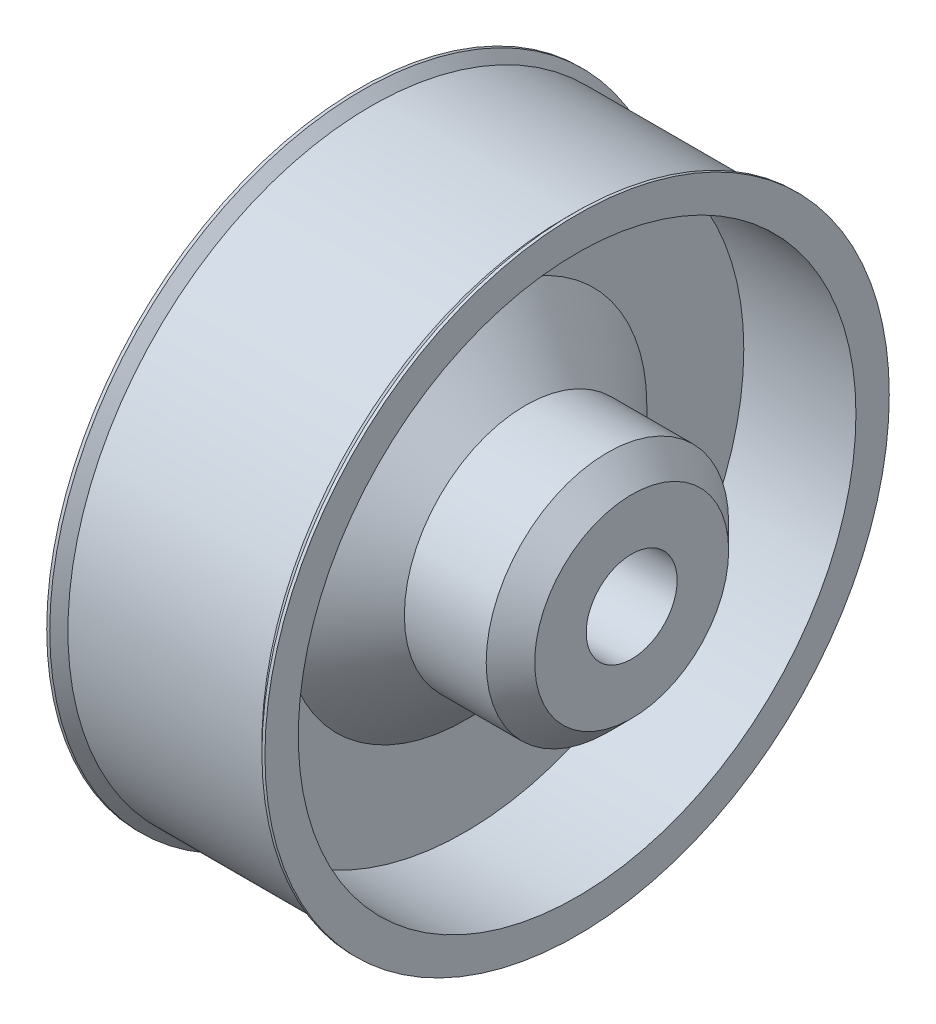
from build123d import *

# Parameters (mm, degrees)
BOSS_EXTRUDE1_DEPTH = 3
CIRPATTERN1_COUNT   = 8
BOSS_EXTRUDE2_DEPTH = 3
CIRPATTERN2_COUNT   = 6


with BuildPart() as part:
    # Sketch1 → Revolve1 (revolve)
    with BuildSketch(Plane.XY, mode=Mode.PRIVATE) as revolve1_sk:
        with BuildLine():
            Line((-7.5, 6), (-17.506303134, 3.75))
            Line((-17.506303134, 3.75), (-18, 0))
            Line((-18, 0), (0, 0))
            Line((0, 0), (0, 7.5))
            Line((0, 7.5), (27.5, 7.5))
            Line((27.5, 7.5), (27.5, 16))
            Line((27.5, 16), (23.5, 20))
            Line((23.5, 20), (10, 20))
            Line((10, 20), (0, 30))
            Line((0, 30), (0, 46))
            Line((0, 46), (18.5, 46))
            Line((18.5, 46), (18.5, 51.5))
            Line((18.5, 51.5), (18, 51.5))
            Line((18, 51.5), (16.5, 50))
            Line((16.5, 50), (-15.5, 50))
            Line((-15.5, 50), (-17, 51.5))
            Line((-17, 51.5), (-17.5, 51.5))
            Line((-17.5, 51.5), (-17.5, 48))
            ThreePointArc((-17.5, 48), (-16.914213562, 46.585786438), (-15.5, 46))
            Line((-15.5, 46), (-10.5, 46))
            ThreePointArc((-10.5, 46), (-8.378679656, 45.121320344), (-7.5, 43))
            Line((-7.5, 43), (-7.5, 33.062305899))
            ThreePointArc((-7.5, 33.062305899), (-8.094648823, 31.269462985), (-9.642857143, 30.187361356))
            ThreePointArc((-9.642857143, 30.187361356), (-15, 23), (-9.642857143, 15.812638644))
            ThreePointArc((-9.642857143, 15.812638644), (-8.094648823, 14.730537015), (-7.5, 12.937694101))
            Line((-7.5, 12.937694101), (-7.5, 6))
        make_face()
    revolve(revolve1_sk.sketch.rotate(Axis((0, 0, 0), (-1, 0, 0)), 90), axis=Axis((0, 0, 0), (-1, 0, 0)))

    # Sketch2 → Boss-Extrude1 (add)
    with BuildSketch(Plane.ZY.offset(7.5)):
        Polygon((-1.443375673, 40), (-2.886751346, 37.5), (-1.443375673, 35), (1.443375673, 35), (2.886751346, 37.5), (1.443375673, 40), align=None)
    boss_extrude1 = extrude(amount=BOSS_EXTRUDE1_DEPTH)

    # CirPattern1: Boss-Extrude1 ×8 about axis
    cirpattern1_axis = Axis((0, 0, 0), (1, 0, 0))
    for i in range(1, CIRPATTERN1_COUNT):
        add(boss_extrude1.rotate(cirpattern1_axis, i * 360 / CIRPATTERN1_COUNT))

    # Sketch3 → Boss-Extrude2 (add)
    with BuildSketch(Plane.ZY.offset(7.5)):
        Polygon((-1.443375673, 12.5), (-2.886751346, 10), (-1.443375673, 7.5), (1.443375673, 7.5), (2.886751346, 10), (1.443375673, 12.5), align=None)
    boss_extrude2 = extrude(amount=BOSS_EXTRUDE2_DEPTH)

    # CirPattern2: Boss-Extrude2 ×6 about axis
    cirpattern2_axis = Axis((0, 0, 0), (1, 0, 0))
    for i in range(1, CIRPATTERN2_COUNT):
        add(boss_extrude2.rotate(cirpattern2_axis, i * 360 / CIRPATTERN2_COUNT))


solid = part.part
